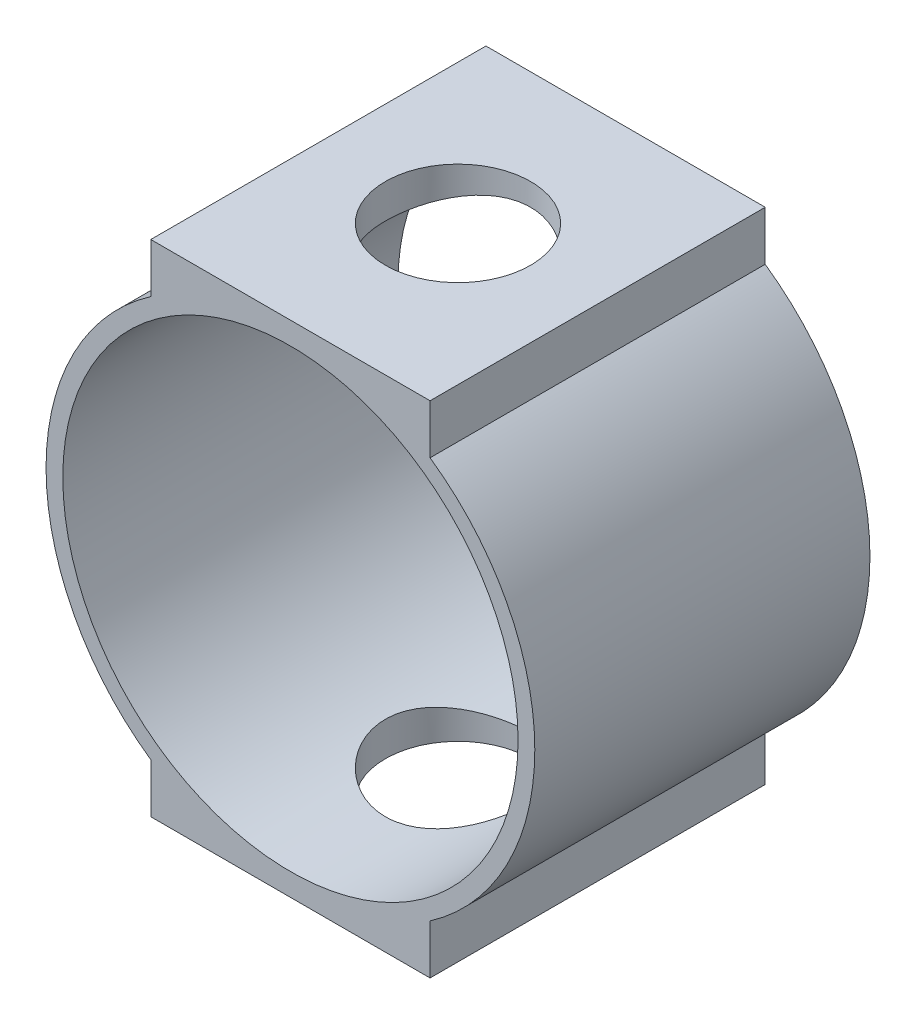
from build123d import *

# Parameters (mm, degrees)
BOSS_EXTRUDE2_DEPTH      = 6
BOSS_EXTRUDE2_DEPTH_BACK = 6
SKETCH1_R                = 8.15
SKETCH2_R                = 2.6
CUT_EXTRUDE1_DEPTH       = 21.807991253


with BuildPart() as part:
    # Sketch1 → Boss-Extrude2 (new, two sides: drawn at the far end of the back side and taken through both)
    with BuildSketch(Plane.XY.offset(-BOSS_EXTRUDE2_DEPTH_BACK)):
        with BuildLine():
            Line((-5, 8.95), (5, 8.95))
            Line((5, 8.95), (5, 7.180703308))
            ThreePointArc((5, 7.180703308), (8.75, 0), (5, -7.180703308))
            Line((5, -7.180703308), (5, -8.95))
            Line((5, -8.95), (-5, -8.95))
            Line((-5, -8.95), (-5, -7.180703308))
            ThreePointArc((-5, -7.180703308), (-8.75, 0), (-5, 7.180703308))
            Line((-5, 7.180703308), (-5, 8.95))
        make_face()
        Circle(SKETCH1_R, mode=Mode.SUBTRACT)
    extrude(amount=BOSS_EXTRUDE2_DEPTH + BOSS_EXTRUDE2_DEPTH_BACK)

    # Sketch2 → Cut-Extrude1 (cut, through all)
    with BuildSketch(Plane(origin=(0, 8.95, 0), x_dir=(1, 0, 0), z_dir=(0, 1, 0))):
        Circle(SKETCH2_R)
    extrude(amount=-CUT_EXTRUDE1_DEPTH, mode=Mode.SUBTRACT)


solid = part.part
